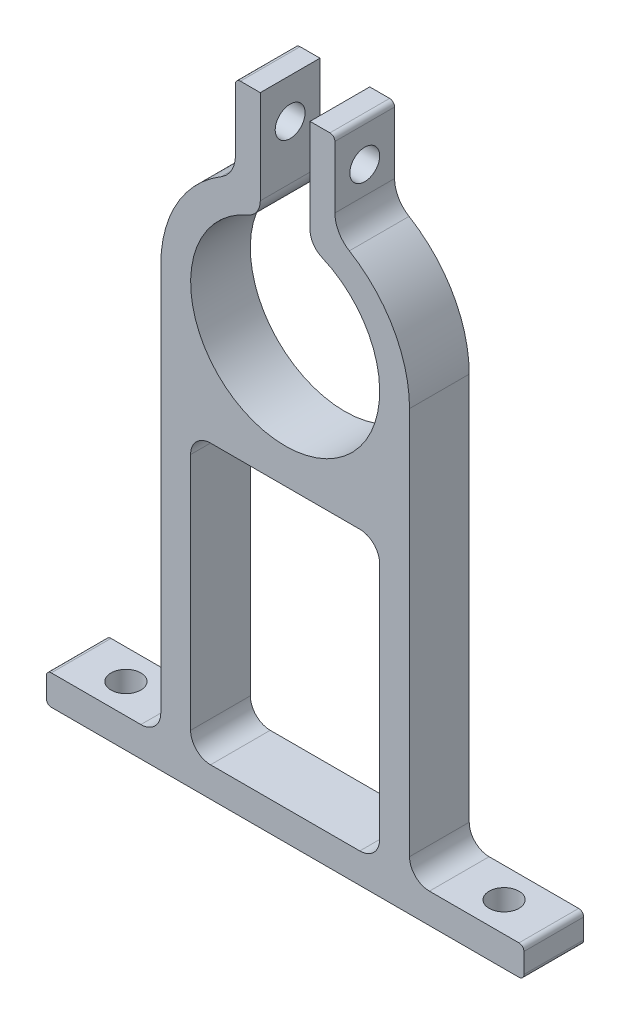
from build123d import *

# Parameters (mm, degrees)
EXTRUDE_1_DEPTH     = 6
SKETCH_2_W          = 19
SKETCH_2_H          = 28
CUT_EXTRUDE_1_DEPTH = 6
FILLET_2_R          = 2
FILLET_3_R          = 2
SKETCH_3_R          = 1.5
CUT_EXTRUDE_2_DEPTH = 6
FILLET_4_R          = 3
FILLET_5_R          = 0.5
SKETCH_4_R          = 1.5
CUT_EXTRUDE_3_DEPTH = 14
FILLET_6_R          = 2


with BuildPart() as part:
    # 草图1 → 凸台-拉伸1 (new body)
    with BuildSketch(Plane.XY):
        with BuildLine():
            Line((12.5, 3), (24, 3))
            Line((24, 3), (24, 0))
            Line((24, 0), (-24, 0))
            Line((-24, 0), (-24, 3))
            Line((-24, 3), (-12.5, 3))
            Line((-12.5, 3), (-12.5, 44))
            ThreePointArc((-12.5, 44), (-10.458250332, 50.846531969), (-5, 55.456439237))
            Line((-5, 55.456439237), (-5, 64))
            Line((-5, 64), (-2.5, 64))
            Line((-2.5, 64), (-2.5, 53.16515139))
            ThreePointArc((-2.5, 53.16515139), (0, 34.5), (2.5, 53.16515139))
            Line((2.5, 53.16515139), (2.5, 64))
            Line((2.5, 64), (5, 64))
            Line((5, 64), (5, 55.456439237))
            ThreePointArc((5, 55.456439237), (10.458250332, 50.846531969), (12.5, 44))
            Line((12.5, 44), (12.5, 3))
        make_face()
    extrude(amount=EXTRUDE_1_DEPTH)

    # 草图2 → 切除-拉伸1 (cut)
    with BuildSketch(Plane.XY.offset(6)):
        with Locations((0, 17)):
            Rectangle(SKETCH_2_W, SKETCH_2_H)
    extrude(amount=-CUT_EXTRUDE_1_DEPTH, mode=Mode.SUBTRACT)

    # 圆角2
    fillet_2_edges = [part.edges().sort_by_distance(p)[0] for p in [
        (-9.5, 3, 3),
        (-9.5, 31, 3),
        (9.5, 31, 3),
        (9.5, 3, 3),
    ]]
    fillet(fillet_2_edges, radius=FILLET_2_R)

    # 圆角3
    fillet_3_edges = [part.edges().sort_by_distance(p)[0] for p in [
        (12.5, 3, 3),
        (-12.5, 3, 3),
    ]]
    fillet(fillet_3_edges, radius=FILLET_3_R)

    # 草图3 → 切除-拉伸2 (cut)
    with BuildSketch(Plane.XZ):
        with Locations(Location((-19, 3, 0), (0, 0, 270))):
            Circle(SKETCH_3_R)
        with Locations(Location((19, 3, 0), (0, 0, 270))):
            Circle(SKETCH_3_R)
    extrude(amount=-CUT_EXTRUDE_2_DEPTH, mode=Mode.SUBTRACT)

    # 圆角4
    fillet_4_edges = [part.edges().sort_by_distance(p)[0] for p in [
        (5, 55.456439237, 3),
        (-5, 55.456439237, 3),
    ]]
    fillet(fillet_4_edges, radius=FILLET_4_R)

    # 圆角5
    fillet_5_edges = [part.edges().sort_by_distance(p)[0] for p in [
        (5, 64, 3),
        (24, 3, 3),
        (24, 0, 3),
        (-24, 0, 3),
        (-24, 3, 3),
        (-5, 64, 3),
    ]]
    fillet(fillet_5_edges, radius=FILLET_5_R)

    # 草图4 → 切除-拉伸3 (cut)
    with BuildSketch(Plane.ZY.offset(5)):
        with Locations((3, 60)):
            Circle(SKETCH_4_R)
    extrude(amount=-CUT_EXTRUDE_3_DEPTH, mode=Mode.SUBTRACT)

    # 圆角6
    fillet_6_edges = [part.edges().sort_by_distance(p)[0] for p in [
        (2.5, 53.16515139, 3),
        (-2.5, 53.16515139, 3),
    ]]
    fillet(fillet_6_edges, radius=FILLET_6_R)


solid = part.part
